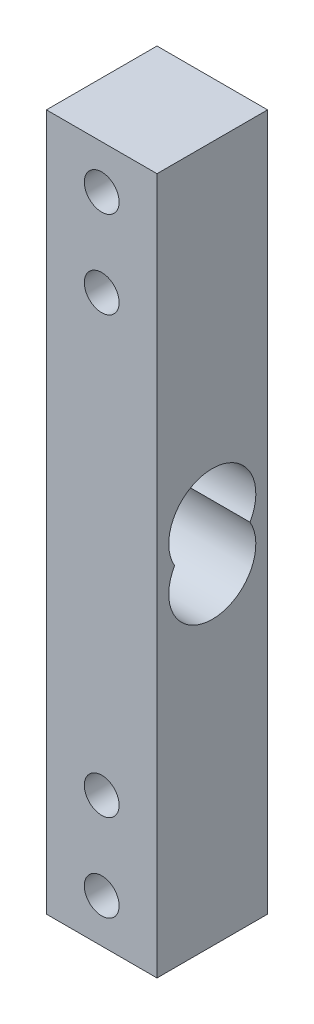
from build123d import *

# Parameters (mm, degrees)
SKETCH1_W           = 12.7
SKETCH1_H           = 12.7
BOSS_EXTRUDE1_DEPTH = 80
CUT_EXTRUDE1_DEPTH  = 80
SKETCH3_R           = 2
CUT_EXTRUDE2_DEPTH  = 80


with BuildPart() as part:
    # Sketch1 → Boss-Extrude1 (new body)
    with BuildSketch(Plane(origin=(0, 0, 0), x_dir=(1, 0, 0), z_dir=(0, 1, 0))):
        with Locations((6.35, -6.35)):
            Rectangle(SKETCH1_W, SKETCH1_H)
    extrude(amount=BOSS_EXTRUDE1_DEPTH)

    # Sketch2 → Cut-Extrude1 (cut)
    with BuildSketch(Plane(origin=(12.7, 0, 0), x_dir=(0, 0, -1), z_dir=(1, 0, 0))):
        with BuildLine():
            ThreePointArc((-10.680127019, 40), (-6.35, 32.5), (-2.019872981, 40))
            ThreePointArc((-2.019872981, 40), (-6.35, 47.5), (-10.680127019, 40))
        make_face()
    extrude(amount=-CUT_EXTRUDE1_DEPTH, mode=Mode.SUBTRACT)

    # Sketch3 → Cut-Extrude2 (cut)
    with BuildSketch(Plane(origin=(0, 0, 0), x_dir=(-1, 0, 0), z_dir=(0, 0, -1))):
        with Locations((-6.35, 5)):
            Circle(SKETCH3_R)
        with Locations((-6.35, 15)):
            Circle(SKETCH3_R)
        with Locations((-6.35, 75)):
            Circle(SKETCH3_R)
        with Locations((-6.35, 65)):
            Circle(SKETCH3_R)
    extrude(amount=-CUT_EXTRUDE2_DEPTH, mode=Mode.SUBTRACT)


solid = part.part
